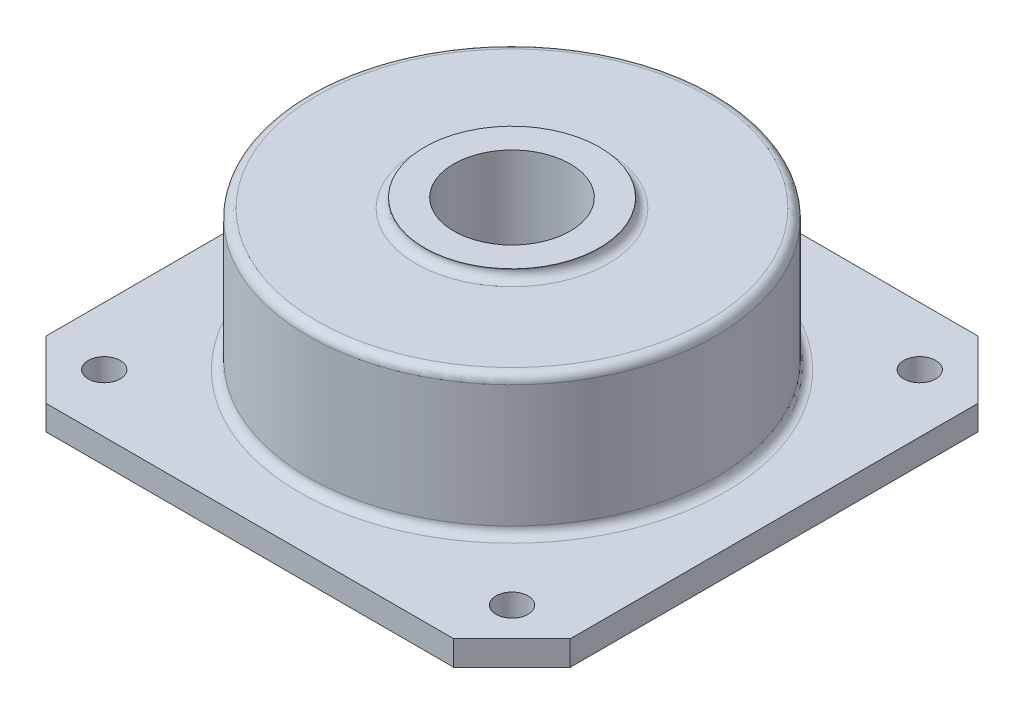
from build123d import *

# Parameters (mm, degrees)
SKETCH_2_W               = 180
SKETCH_2_H               = 180
EXTRUDE_1_DEPTH          = 8.5
CHAMFER_1_SIZE           = 20
SKETCH_4_R               = 5.5
CUT_EXTRUDE_1_DEPTH      = 8.5
MIRROR_2_COPY_1_SKETCH_R = 5.5
MIRROR_2_COPY_1_DEPTH    = 8.5
SKETCH_5_R               = 20
CUT_EXTRUDE_2_DEPTH      = 1089.345359905


with BuildPart() as part:
    # 草图1 → 旋转1 (revolve)
    with BuildSketch(Plane.XY, mode=Mode.PRIVATE) as revolve_1_sk:
        with BuildLine():
            ThreePointArc((922.973468016, 268.381765717), (922.094788359, 266.260445373), (919.973468016, 265.381765717))
            Line((919.973468016, 265.381765717), (922.973468016, 265.381765717))
            Line((922.973468016, 265.381765717), (992.973468016, 265.381765717))
            Line((992.973468016, 265.381765717), (992.973468016, 313.381765717))
            Line((992.973468016, 313.381765717), (959.973468016, 313.381765717))
            Line((959.973468016, 313.381765717), (925.973468016, 313.381765717))
            ThreePointArc((925.973468016, 313.381765717), (923.852147672, 312.50308606), (922.973468016, 310.381765717))
            Line((922.973468016, 310.381765717), (922.973468016, 268.381765717))
        make_face()
        with BuildLine():
            Line((959.973468016, 313.381765717), (992.973468016, 313.381765717))
            Line((992.973468016, 313.381765717), (992.973468016, 316.581765717))
            Line((992.973468016, 316.581765717), (962.973468016, 316.581765717))
            Line((962.973468016, 316.581765717), (962.973468016, 316.381765717))
            ThreePointArc((962.973468016, 316.381765717), (962.094788359, 314.260445373), (959.973468016, 313.381765717))
        make_face()
    revolve(revolve_1_sk.sketch.rotate(Axis((992.973468016, 256.881765717, 0), (0, 1, 0)), 270), axis=Axis((992.973468016, 256.881765717, 0), (0, 1, 0)))

    # 草图2 → 凸台-拉伸1 (add)
    with BuildSketch(Plane.XZ.offset(-265.381765717)):
        with Locations((992.973468016, 0)):
            Rectangle(SKETCH_2_W, SKETCH_2_H)
    extrude(amount=EXTRUDE_1_DEPTH)

    # 倒角1
    chamfer_1_edges = [part.edges().sort_by_distance(p)[0] for p in [
        (1082.973468016, 261.131765717, -90),
        (1082.973468016, 261.131765717, 90),
        (902.973468016, 261.131765717, 90),
        (902.973468016, 261.131765717, -90),
    ]]
    chamfer(chamfer_1_edges, length=CHAMFER_1_SIZE)

    # 草图4 → 切除-拉伸1 (cut)
    with BuildSketch(Plane.XZ.offset(-256.881765717)):
        with Locations(Location((1062.973468016, 70, 0), (0, 0, 270))):
            Circle(SKETCH_4_R)
    cut_extrude_1 = extrude(amount=-CUT_EXTRUDE_1_DEPTH, mode=Mode.SUBTRACT)

    # 镜向1: 切除-拉伸1 across plane
    add(cut_extrude_1.mirror(Plane.XY), mode=Mode.SUBTRACT)

    # 镜向2: 切除-拉伸1 across plane
    add(cut_extrude_1.mirror(Plane.ZY.offset(-992.973468016)), mode=Mode.SUBTRACT)

    # 镜向2 copy 1 sketch → 镜向2 copy 1 (cut)
    with BuildSketch(Plane(origin=(1985.946936032, 256.881765717, 0), x_dir=(-1, 0, 0), z_dir=(0, -1, 0))):
        with Locations(Location((1062.973468016, 70, 0), (0, 0, 270))):
            Circle(MIRROR_2_COPY_1_SKETCH_R)
    extrude(amount=-MIRROR_2_COPY_1_DEPTH, mode=Mode.SUBTRACT)

    # 草图5 → 切除-拉伸2 (cut, through all)
    with BuildSketch(Plane.XZ.offset(-256.881765717)):
        with Locations(Location((992.973468016, 0, 0), (0, 0, 270))):
            Circle(SKETCH_5_R)
    extrude(amount=-CUT_EXTRUDE_2_DEPTH, mode=Mode.SUBTRACT)


solid = part.part
